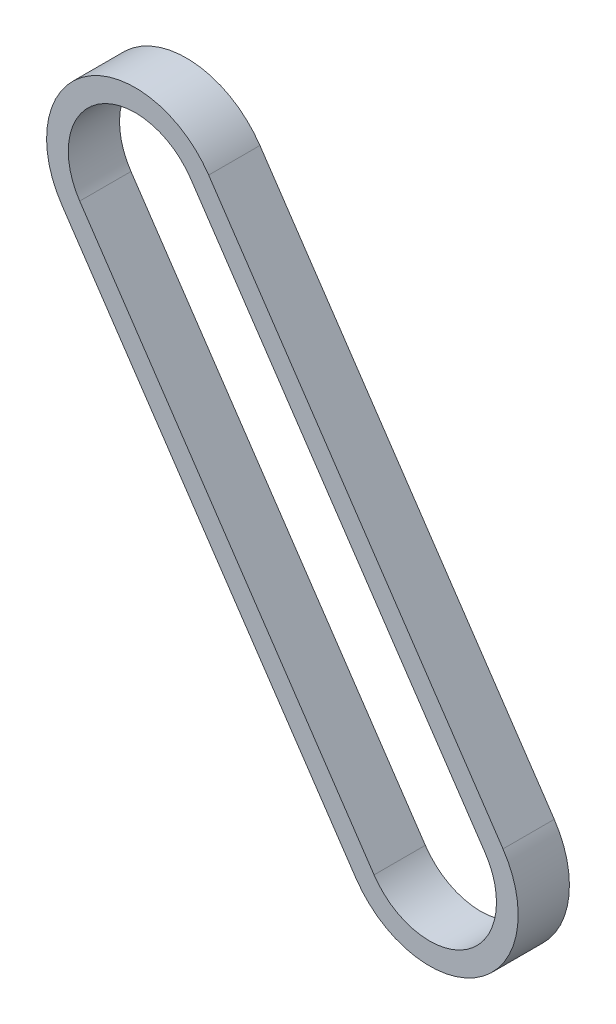
from build123d import *

# Parameters (mm, degrees)
EXTRUDE_THIN1_DEPTH = 4.5


with BuildPart() as part:
    # Sketch2 → Extrude-Thin1 (new, symmetric)
    with BuildSketch(Plane.XY):
        with BuildLine():
            Line((-38.787444516, 85.336101627), (12.902389333, 8.702771493))
            ThreePointArc((12.902389333, 8.702771493), (8.702771493, -12.902389333), (-12.902389333, -8.702771493))
            Line((-12.902389333, -8.702771493), (-64.592223182, 67.930558641))
            ThreePointArc((-64.592223182, 67.930558641), (-60.392605342, 89.535719467), (-38.787444516, 85.336101627))
        make_face()
        with BuildLine():
            Line((-41.946077668, 83.205576664), (9.743756182, 6.572246531))
            ThreePointArc((9.743756182, 6.572246531), (6.572246531, -9.743756182), (-9.743756182, -6.572246531))
            Line((-9.743756182, -6.572246531), (-61.433590031, 70.061083603))
            ThreePointArc((-61.433590031, 70.061083603), (-58.26208038, 86.377086316), (-41.946077668, 83.205576664))
        make_face(mode=Mode.SUBTRACT)
    extrude(amount=EXTRUDE_THIN1_DEPTH, both=True)


solid = part.part
